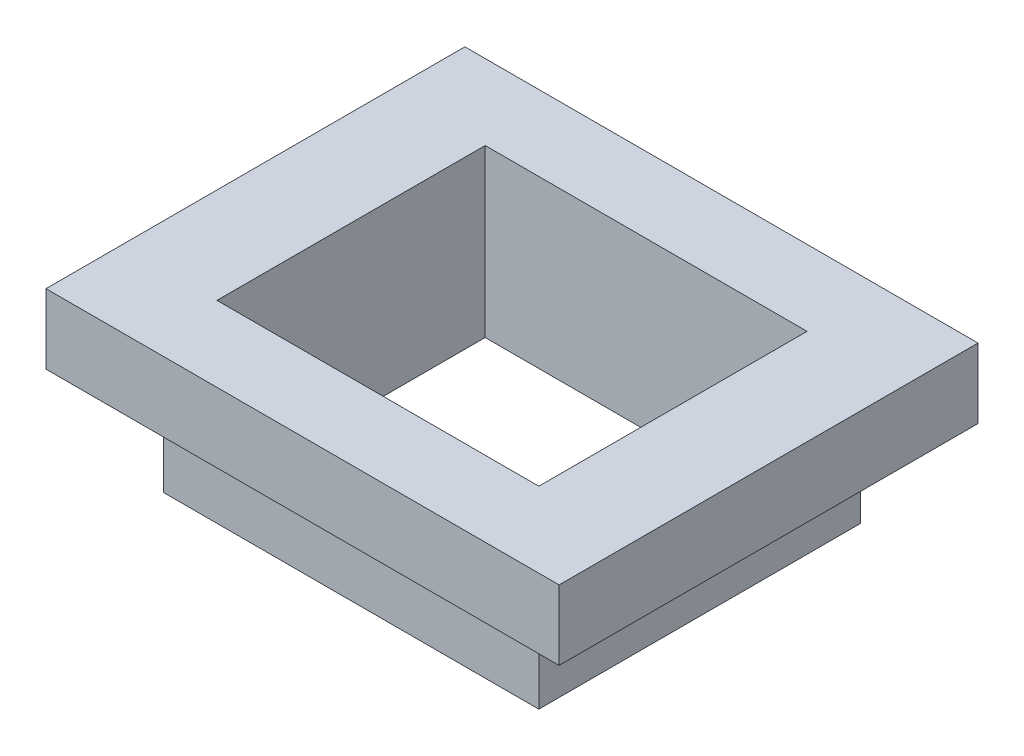
from build123d import *

# Parameters (mm, degrees)
SKETCH1_W           = 956.53
SKETCH1_H           = 780.88
BOSS_EXTRUDE1_DEPTH = 130
SKETCH2_W           = 600
SKETCH2_H           = 500
BOSS_EXTRUDE2_DEPTH = 180


with BuildPart() as part:
    # Sketch1 → Boss-Extrude1 (new body)
    with BuildSketch(Plane(origin=(0, 0, 0), x_dir=(1, 0, 0), z_dir=(0, 1, 0))):
        with Locations((17.286686747, -229.097590361)):
            Rectangle(SKETCH1_W, SKETCH1_H)
        Polygon((17.286686747, 20.902409639), (317.286686747, 20.902409639), (317.286686747, -229.097590361), (317.286686747, -479.097590361), (17.286686747, -479.097590361), (-282.713313253, -479.097590361), (-282.713313253, -229.097590361), (-282.713313253, 20.902409639), align=None, mode=Mode.SUBTRACT)
    extrude(amount=BOSS_EXTRUDE1_DEPTH)

    # Sketch2 → Boss-Extrude2 (add)
    with BuildSketch(Plane.XZ):
        Polygon((367.286686747, -70.902409639), (367.286686747, -20.902409639), (367.286686747, 479.097590361), (367.286686747, 529.097590361), (-332.713313253, 529.097590361), (-332.713313253, 479.097590361), (-332.713313253, -70.902409639), (-282.713313253, -70.902409639), align=None)
        with Locations((17.286686747, 229.097590361)):
            Rectangle(SKETCH2_W, SKETCH2_H, mode=Mode.SUBTRACT)
    extrude(amount=BOSS_EXTRUDE2_DEPTH)


solid = part.part
